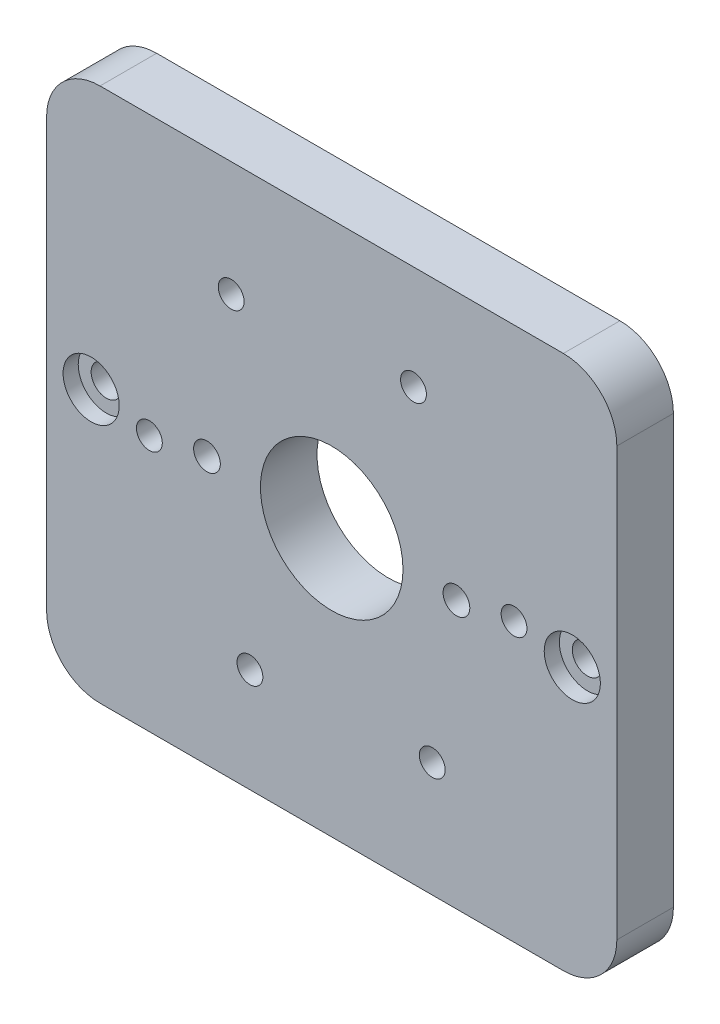
from build123d import *

# Parameters (mm, degrees)
REPISA_M4_START                       = 222.25
REPISA_M4_DEPTH                       = 6.35
BARRENOS_M4_TORNILLOS_PASADORES_START = 222.25
CROQUIS2_R                            = 1.45
CROQUIS2_R_2                          = 8
CROQUIS2_R_3                          = 1.7
CROQUIS2_R_4                          = 1.5
BARRENOS_M4_TORNILLOS_PASADORES_DEPTH = 6.35
REFRENTADO_M2_5_START                 = 222.25
CROQUIS3_R                            = 2.5
REFRENTADO_M2_5_DEPTH                 = 2.6
AVELLANADO_M3_START                   = 226.9
CROQUIS4_R                            = 3.15
AVELLANADO_M3_DEPTH                   = 1.7


with BuildPart() as part:
    # Croquis1 → Repisa_M4 (new body)
    with BuildSketch(Plane.XY.offset(REPISA_M4_START)):
        with BuildLine():
            Line((126.4, -30), (178.4, -30))
            ThreePointArc((178.4, -30), (182.642640687, -28.242640687), (184.4, -24))
            Line((184.4, -24), (184.4, 24))
            ThreePointArc((184.4, 24), (182.642640687, 28.242640687), (178.4, 30))
            Line((178.4, 30), (126.4, 30))
            ThreePointArc((126.4, 30), (122.157359313, 28.242640687), (120.4, 24))
            Line((120.4, 24), (120.4, -24))
            ThreePointArc((120.4, -24), (122.157359313, -28.242640687), (126.4, -30))
        make_face()
    extrude(amount=REPISA_M4_DEPTH)

    # Croquis2 → Barrenos_M4_tornillos_pasadores (cut)
    with BuildSketch(Plane.XY.offset(BARRENOS_M4_TORNILLOS_PASADORES_START)):
        with Locations((172.863916472, 1.215780658)):
            Circle(CROQUIS2_R)
        with Locations((161.579061301, 18.330161855)):
            Circle(CROQUIS2_R)
        with Locations((141.115144828, 17.114381197)):
            Circle(CROQUIS2_R)
        with Locations((131.936083528, -1.215780658)):
            Circle(CROQUIS2_R)
        with Locations((143.220938699, -18.330161855)):
            Circle(CROQUIS2_R)
        with Locations((163.684855172, -17.114381197)):
            Circle(CROQUIS2_R)
        with Locations((152.4, 0)):
            Circle(CROQUIS2_R_2)
        with Locations((125.4, 0)):
            Circle(CROQUIS2_R_3)
        with Locations((179.4, 0)):
            Circle(CROQUIS2_R_3)
        with Locations((138.4, 0)):
            Circle(CROQUIS2_R_4)
        with Locations((166.4, 0)):
            Circle(CROQUIS2_R_4)
    extrude(amount=BARRENOS_M4_TORNILLOS_PASADORES_DEPTH, mode=Mode.SUBTRACT)

    # Croquis3 → Refrentado_M2-5 (cut)
    with BuildSketch(Plane.XY.offset(REFRENTADO_M2_5_START)):
        with Locations((172.863916472, 1.215780658)):
            Circle(CROQUIS3_R)
        with Locations((161.579061301, 18.330161855)):
            Circle(CROQUIS3_R)
        with Locations((141.115144828, 17.114381197)):
            Circle(CROQUIS3_R)
        with Locations((131.936083528, -1.215780658)):
            Circle(CROQUIS3_R)
        with Locations((143.220938699, -18.330161855)):
            Circle(CROQUIS3_R)
        with Locations((163.684855172, -17.114381197)):
            Circle(CROQUIS3_R)
    extrude(amount=REFRENTADO_M2_5_DEPTH, mode=Mode.SUBTRACT)

    # Croquis4 → Avellanado_M3 (cut)
    with BuildSketch(Plane.XY.offset(AVELLANADO_M3_START)):
        with Locations(Location((125.4, 0, 0), (0, 0, 180))):
            Circle(CROQUIS4_R)
        with Locations(Location((179.4, 0, 0), (0, 0, 180))):
            Circle(CROQUIS4_R)
    extrude(amount=AVELLANADO_M3_DEPTH, mode=Mode.SUBTRACT)


solid = part.part
